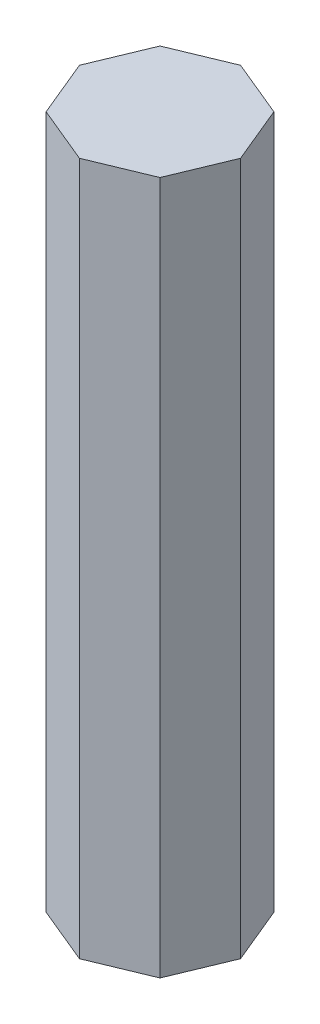
from build123d import *

# Parameters (mm, degrees)
BOSS_EXTRUDE1_DEPTH = 500


with BuildPart() as part:
    # Sketch1 → Boss-Extrude1 (new body)
    with BuildSketch(Plane(origin=(0, 0, 0), x_dir=(1, 0, 0), z_dir=(0, 1, 0))):
        Polygon((0, 58.089789418), (-41.075684015, 41.075684015), (-58.089789418, 0), (-41.075684015, -41.075684015), (0, -58.089789418), (41.075684015, -41.075684015), (58.089789418, 0), (41.075684015, 41.075684015), align=None)
    extrude(amount=BOSS_EXTRUDE1_DEPTH)


solid = part.part
